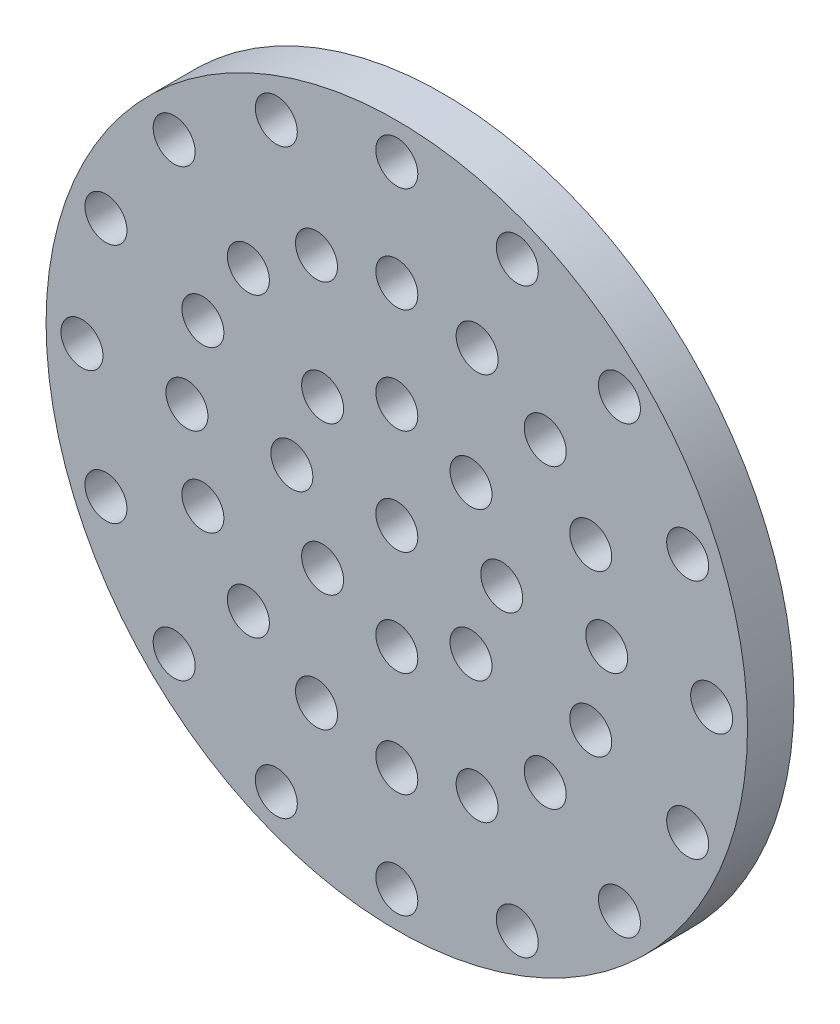
from build123d import *

# Parameters (mm, degrees)
SKETCH1_R           = 16.71
SKETCH1_R_2         = 1
BOSS_EXTRUDE2_DEPTH = 2.21


with BuildPart() as part:
    # Sketch1 → Boss-Extrude2 (new body)
    with BuildSketch(Plane.XY):
        Circle(SKETCH1_R)
        Circle(SKETCH1_R_2, mode=Mode.SUBTRACT)
        with Locations((5, 0)):
            Circle(SKETCH1_R_2, mode=Mode.SUBTRACT)
        with Locations((10, 0)):
            Circle(SKETCH1_R_2, mode=Mode.SUBTRACT)
        with Locations((15, 0)):
            Circle(SKETCH1_R_2, mode=Mode.SUBTRACT)
        with Locations((3.535533906, -3.535533906)):
            Circle(SKETCH1_R_2, mode=Mode.SUBTRACT)
        with Locations((0, -5)):
            Circle(SKETCH1_R_2, mode=Mode.SUBTRACT)
        with Locations((-3.535533906, -3.535533906)):
            Circle(SKETCH1_R_2, mode=Mode.SUBTRACT)
        with Locations((-5, 0)):
            Circle(SKETCH1_R_2, mode=Mode.SUBTRACT)
        with Locations((-3.535533906, 3.535533906)):
            Circle(SKETCH1_R_2, mode=Mode.SUBTRACT)
        with Locations((0, 5)):
            Circle(SKETCH1_R_2, mode=Mode.SUBTRACT)
        with Locations((3.535533906, 3.535533906)):
            Circle(SKETCH1_R_2, mode=Mode.SUBTRACT)
        with Locations((9.238795325, -3.826834324)):
            Circle(SKETCH1_R_2, mode=Mode.SUBTRACT)
        with Locations((7.071067812, -7.071067812)):
            Circle(SKETCH1_R_2, mode=Mode.SUBTRACT)
        with Locations((3.826834324, -9.238795325)):
            Circle(SKETCH1_R_2, mode=Mode.SUBTRACT)
        with Locations((0, -10)):
            Circle(SKETCH1_R_2, mode=Mode.SUBTRACT)
        with Locations((-3.826834324, -9.238795325)):
            Circle(SKETCH1_R_2, mode=Mode.SUBTRACT)
        with Locations((-7.071067812, -7.071067812)):
            Circle(SKETCH1_R_2, mode=Mode.SUBTRACT)
        with Locations((-9.238795325, -3.826834324)):
            Circle(SKETCH1_R_2, mode=Mode.SUBTRACT)
        with Locations((-10, 0)):
            Circle(SKETCH1_R_2, mode=Mode.SUBTRACT)
        with Locations((-9.238795325, 3.826834324)):
            Circle(SKETCH1_R_2, mode=Mode.SUBTRACT)
        with Locations((-7.071067812, 7.071067812)):
            Circle(SKETCH1_R_2, mode=Mode.SUBTRACT)
        with Locations((-3.826834324, 9.238795325)):
            Circle(SKETCH1_R_2, mode=Mode.SUBTRACT)
        with Locations((0, 10)):
            Circle(SKETCH1_R_2, mode=Mode.SUBTRACT)
        with Locations((3.826834324, 9.238795325)):
            Circle(SKETCH1_R_2, mode=Mode.SUBTRACT)
        with Locations((7.071067812, 7.071067812)):
            Circle(SKETCH1_R_2, mode=Mode.SUBTRACT)
        with Locations((9.238795325, 3.826834324)):
            Circle(SKETCH1_R_2, mode=Mode.SUBTRACT)
        with Locations((13.858192988, -5.740251485)):
            Circle(SKETCH1_R_2, mode=Mode.SUBTRACT)
        with Locations((10.606601718, -10.606601718)):
            Circle(SKETCH1_R_2, mode=Mode.SUBTRACT)
        with Locations((5.740251485, -13.858192988)):
            Circle(SKETCH1_R_2, mode=Mode.SUBTRACT)
        with Locations((0, -15)):
            Circle(SKETCH1_R_2, mode=Mode.SUBTRACT)
        with Locations((-5.740251485, -13.858192988)):
            Circle(SKETCH1_R_2, mode=Mode.SUBTRACT)
        with Locations((-10.606601718, -10.606601718)):
            Circle(SKETCH1_R_2, mode=Mode.SUBTRACT)
        with Locations((-13.858192988, -5.740251485)):
            Circle(SKETCH1_R_2, mode=Mode.SUBTRACT)
        with Locations((-15, 0)):
            Circle(SKETCH1_R_2, mode=Mode.SUBTRACT)
        with Locations((-13.858192988, 5.740251485)):
            Circle(SKETCH1_R_2, mode=Mode.SUBTRACT)
        with Locations((-10.606601718, 10.606601718)):
            Circle(SKETCH1_R_2, mode=Mode.SUBTRACT)
        with Locations((-5.740251485, 13.858192988)):
            Circle(SKETCH1_R_2, mode=Mode.SUBTRACT)
        with Locations((0, 15)):
            Circle(SKETCH1_R_2, mode=Mode.SUBTRACT)
        with Locations((5.740251485, 13.858192988)):
            Circle(SKETCH1_R_2, mode=Mode.SUBTRACT)
        with Locations((10.606601718, 10.606601718)):
            Circle(SKETCH1_R_2, mode=Mode.SUBTRACT)
        with Locations((13.858192988, 5.740251485)):
            Circle(SKETCH1_R_2, mode=Mode.SUBTRACT)
    extrude(amount=BOSS_EXTRUDE2_DEPTH)


solid = part.part
